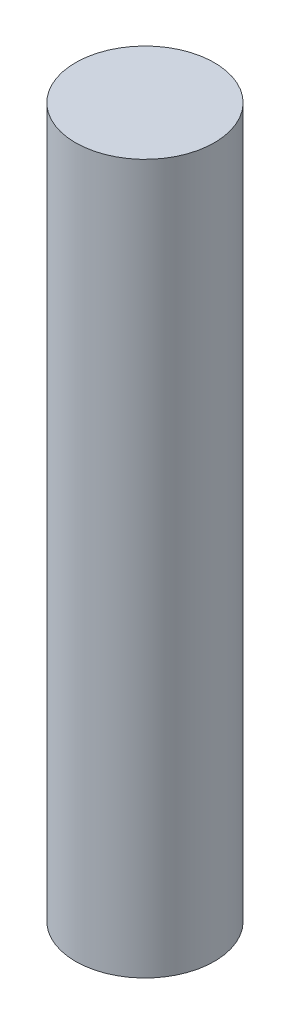
from build123d import *

# Parameters (mm, degrees)
SKETCH1_R           = 2.35
BOSS_EXTRUDE1_DEPTH = 24


with BuildPart() as part:
    # Sketch1 → Boss-Extrude1 (new body)
    with BuildSketch(Plane(origin=(0, 0, 0), x_dir=(1, 0, 0), z_dir=(0, 1, 0))):
        with Locations(Location((0, 0, 0), (0, 0, 270))):
            Circle(SKETCH1_R)
    extrude(amount=BOSS_EXTRUDE1_DEPTH)


solid = part.part
